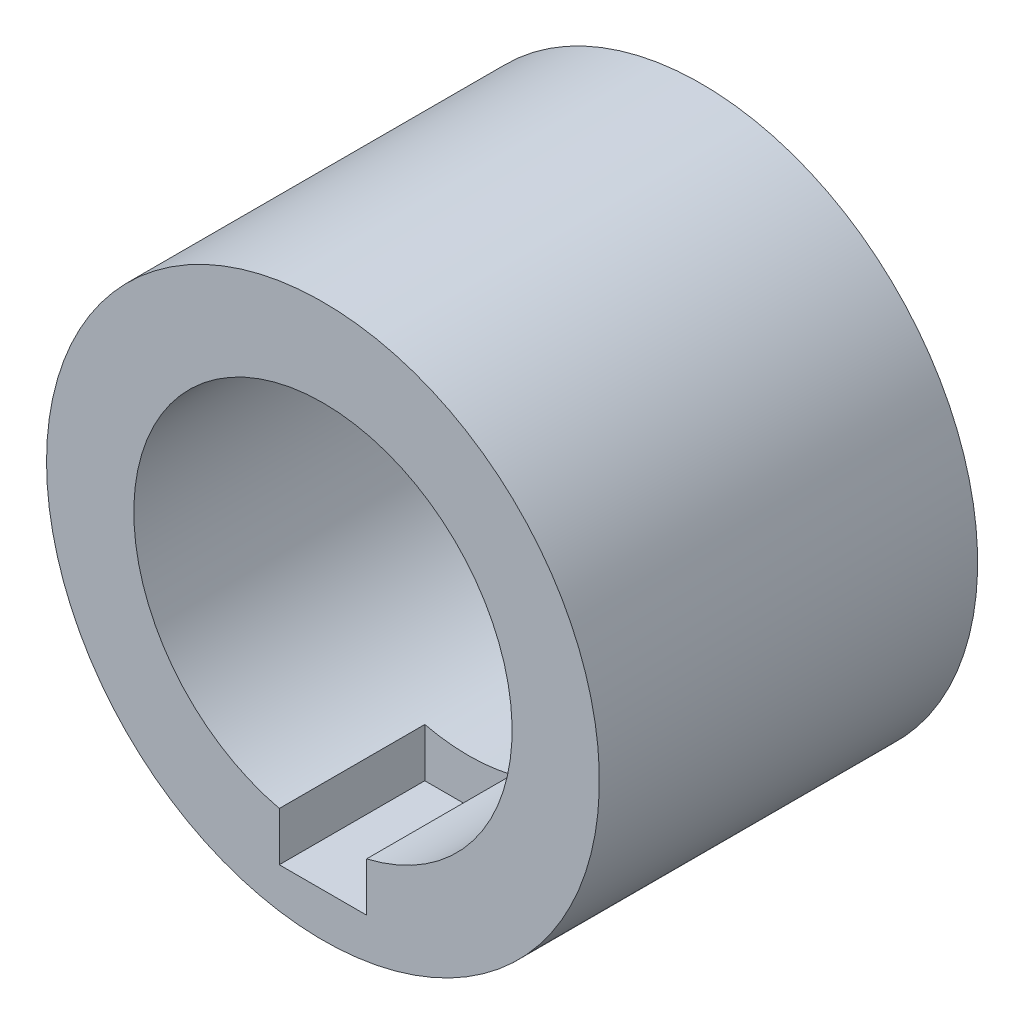
from build123d import *

# Parameters (mm, degrees)
SKETCH1_R               = 9.5
SKETCH1_R_2             = 6.5
BOSS_EXTRUDE1_DEPTH     = 6.5
CUT_EXTRUDE1_REACH      = 24.925
CUT_EXTRUDE1_END_RADIUS = 6.5
CUT_EXTRUDE1_START      = -8
SKETCH2_W               = 3
SKETCH2_H               = 5


with BuildPart() as part:
    # Sketch1 → Boss-Extrude1 (new, symmetric)
    with BuildSketch(Plane.XY):
        with Locations(Location((0, 0, 0), (0, 0, 180))):
            Circle(SKETCH1_R)
        with Locations(Location((0, 0, 0), (0, 0, 180))):
            Circle(SKETCH1_R_2, mode=Mode.SUBTRACT)
    extrude(amount=BOSS_EXTRUDE1_DEPTH, both=True)

    # Cut-Extrude1: up to this cylinder (the profile starts outside it)
    cut_extrude1_end = Plane(origin=(0, 0, 4), z_dir=(0, 0, -1)) * Cylinder(CUT_EXTRUDE1_END_RADIUS, 63.85, mode=Mode.PRIVATE)
    # Sketch2 → Cut-Extrude1 (cut, up to the surface)
    with BuildSketch(Plane(origin=(0, 0, 0), x_dir=(1, 0, 0), z_dir=(0, 1, 0)).offset(CUT_EXTRUDE1_START), mode=Mode.PRIVATE) as cut_extrude1_sk1:
        with Locations((0, -4)):
            Rectangle(SKETCH2_W, SKETCH2_H)
    cut_extrude1_tool1 = extrude(cut_extrude1_sk1.sketch, amount=CUT_EXTRUDE1_REACH, mode=Mode.PRIVATE) - cut_extrude1_end
    add(cut_extrude1_tool1.solids().sort_by_distance((0, -8, 4))[0], mode=Mode.SUBTRACT)


solid = part.part
